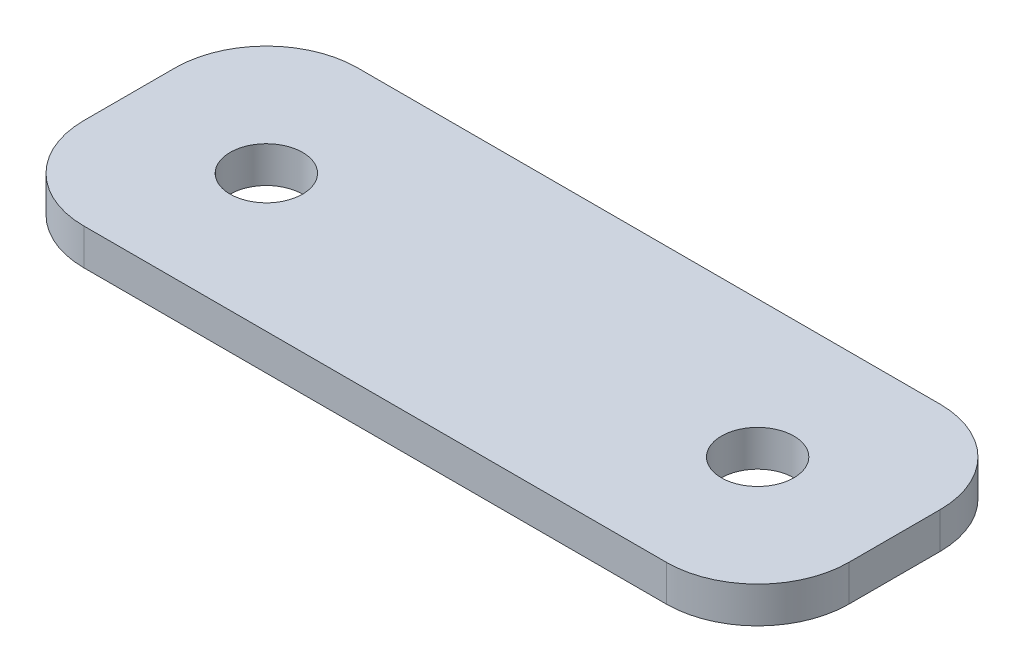
from build123d import *

# Parameters (mm, degrees)
SKETCH1_W           = 33.53
SKETCH1_H           = 12
SKETCH1_R           = 1.5875
BOSS_EXTRUDE1_DEPTH = 0.79375
FILLET1_R           = 4


with BuildPart() as part:
    # Sketch1 → Boss-Extrude1 (new, symmetric)
    with BuildSketch(Plane(origin=(0, 0, 0), x_dir=(1, 0, 0), z_dir=(0, 1, 0))):
        Rectangle(SKETCH1_W, SKETCH1_H)
        with Locations(Location((-10.765, 0, 0), (0, 0, 270))):
            Circle(SKETCH1_R, mode=Mode.SUBTRACT)
        with Locations(Location((10.765, 0, 0), (0, 0, 270))):
            Circle(SKETCH1_R, mode=Mode.SUBTRACT)
    extrude(amount=BOSS_EXTRUDE1_DEPTH, both=True)

    # Fillet1
    fillet1_edges = [part.edges().sort_by_distance(p)[0] for p in [
        (-16.765, 0, -6),
        (16.765, 0, -6),
        (16.765, 0, 6),
        (-16.765, 0, 6),
    ]]
    fillet(fillet1_edges, radius=FILLET1_R)


solid = part.part
